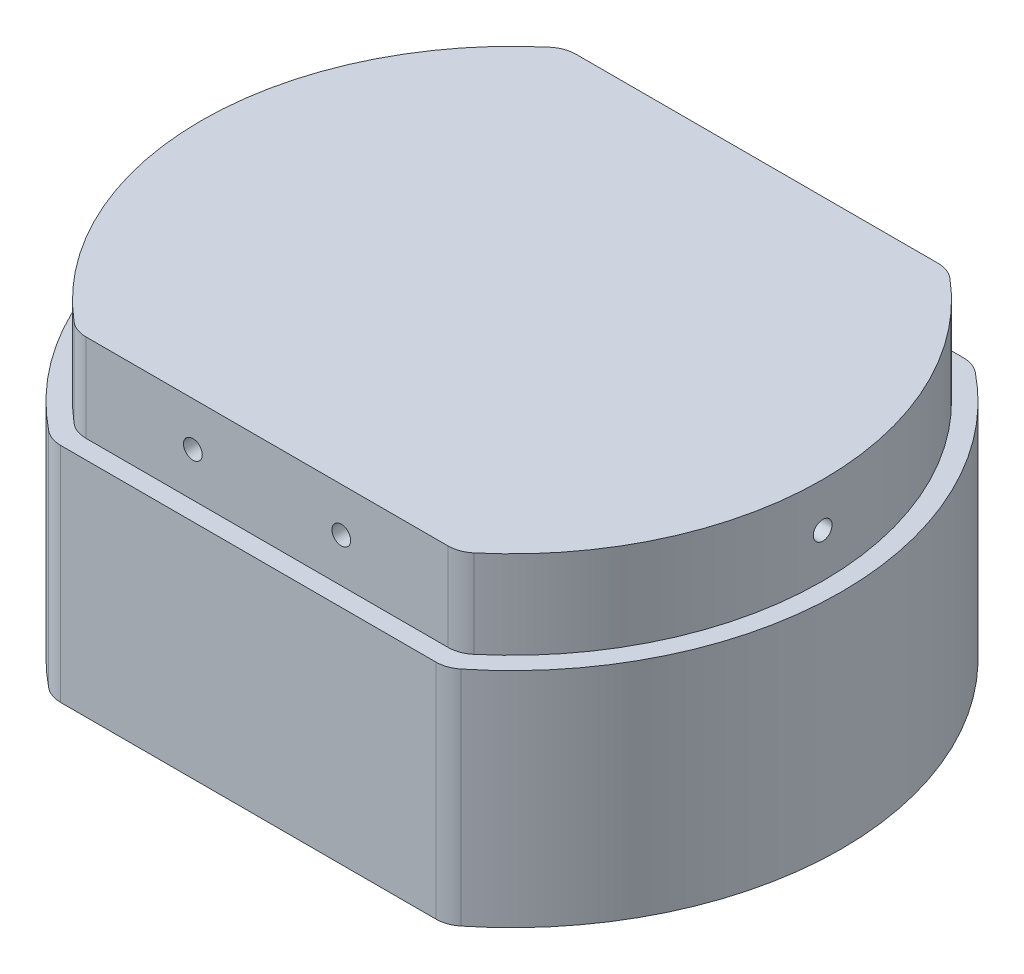
from build123d import *

# Parameters (mm, degrees)
Y_KSEKLIK_EKSTR_ZYON1_DEPTH = 53
KES_EKSTR_ZYON1_START       = -15
KES_EKSTR_ZYON1_DEPTH       = 15
M3_BO_LUKLU_DELIK2_D        = 3.2
M3_BO_LUKLU_DELIK2_DEPTH    = 6.9
M3_BO_LUKLU_DELIK2_TIP      = 0.96137699
M3_BO_LUKLU_DELIK1_D        = 3.2
M3_BO_LUKLU_DELIK1_DEPTH    = 6.9
M3_BO_LUKLU_DELIK1_TIP      = 0.96137699
RADYUS1_R                   = 5
DAIRESEL_KAPLAMA1_COUNT     = 2
DAIRESEL_KAPLAMA1_ANGLE     = 180


with BuildPart() as part:
    # Çizim1 → Yükseklik-Ekstrüzyon1 (new body)
    with BuildSketch(Plane(origin=(0, 0, 0), x_dir=(1, 0, 0), z_dir=(0, 1, 0))):
        with BuildLine():
            Line((-32.040014045, 45), (32.040014045, 45))
            ThreePointArc((32.040014045, 45), (33.696486936, 44.717636862), (35.165869074, 43.902439024))
            ThreePointArc((35.165869074, 43.902439024), (56.25, 0), (35.165869074, -43.902439024))
            ThreePointArc((35.165869074, -43.902439024), (33.696486936, -44.717636862), (32.040014045, -45))
            Line((32.040014045, -45), (-32.040014045, -45))
            ThreePointArc((-32.040014045, -45), (-33.696486936, -44.717636862), (-35.165869074, -43.902439024))
            ThreePointArc((-35.165869074, -43.902439024), (-56.25, 0), (-35.165869074, 43.902439024))
            ThreePointArc((-35.165869074, 43.902439024), (-33.696486936, 44.717636862), (-32.040014045, 45))
        make_face()
    extrude(amount=Y_KSEKLIK_EKSTR_ZYON1_DEPTH)

    # Çizim2 → Kes-Ekstrüzyon1 (cut)
    with BuildSketch(Plane(origin=(0, 53, 0), x_dir=(1, 0, 0), z_dir=(0, 1, 0)).offset(KES_EKSTR_ZYON1_START)):
        with BuildLine():
            Line((33.75, 45), (-33.75, 45))
            ThreePointArc((-33.75, 45), (-56.25, 0), (-33.75, -45))
            Line((-33.75, -45), (33.75, -45))
            ThreePointArc((33.75, -45), (56.25, 0), (33.75, 45))
        make_face()
        with BuildLine():
            Line((32.665922611, -41.8), (-32.665922611, -41.8))
            ThreePointArc((-32.665922611, -41.8), (-53.05, 0), (-32.665922611, 41.8))
            Line((-32.665922611, 41.8), (32.665922611, 41.8))
            ThreePointArc((32.665922611, 41.8), (53.05, 0), (32.665922611, -41.8))
        make_face(mode=Mode.SUBTRACT)
    extrude(amount=KES_EKSTR_ZYON1_DEPTH, mode=Mode.SUBTRACT)

    # M3 Boşluklu Delik2
    with Locations(Plane(origin=(0, 0, -41.8), x_dir=(-1, 0, 0), z_dir=(0, 0, -1))):
        with Locations((12.665922611, 45.5), (-12.665922611, 45.5)):
            Hole(M3_BO_LUKLU_DELIK2_D / 2, depth=M3_BO_LUKLU_DELIK2_DEPTH)
            with Locations((0, 0, -(M3_BO_LUKLU_DELIK2_DEPTH + M3_BO_LUKLU_DELIK2_TIP / 2))):  # 118° drill point
                Cone(0, M3_BO_LUKLU_DELIK2_D / 2, M3_BO_LUKLU_DELIK2_TIP, mode=Mode.SUBTRACT)

    # M3 Boşluklu Delik1
    with Locations(Plane.XY.offset(41.8)):
        with Locations((12.665922611, 45.5), (-12.665922611, 45.5)):
            Hole(M3_BO_LUKLU_DELIK1_D / 2, depth=M3_BO_LUKLU_DELIK1_DEPTH)
            with Locations((0, 0, -(M3_BO_LUKLU_DELIK1_DEPTH + M3_BO_LUKLU_DELIK1_TIP / 2))):  # 118° drill point
                Cone(0, M3_BO_LUKLU_DELIK1_D / 2, M3_BO_LUKLU_DELIK1_TIP, mode=Mode.SUBTRACT)

    # Radyus1
    radyus1_edges = [part.edges().sort_by_distance(p)[0] for p in [
        (-32.665922611, 45.5, -41.8),
        (32.665922611, 45.5, -41.8),
        (32.665922611, 45.5, 41.8),
        (-32.665922611, 45.5, 41.8),
    ]]
    fillet(radyus1_edges, radius=RADYUS1_R)

    # Çizim19 → M3 Boşluklu Delik3 (revolve, cut)
    with BuildSketch(Plane(origin=(53.05, 45.5, 0), x_dir=(0, 0, -1), z_dir=(0, 1, 0))):
        Polygon((0, 0), (0, 12.76137699), (1.6, 11.8), (1.6, 0), align=None)
    m3_bo_luklu_delik3 = revolve(axis=Axis((59.4, 45.5, 0), (-1, 0, 0)), mode=Mode.SUBTRACT)

    # Dairesel Kaplama1: M3 Boşluklu Delik3 ×2 about axis
    dairesel_kaplama1_axis = Axis((0, 53, 0), (0, 1, 0))
    for i in range(1, DAIRESEL_KAPLAMA1_COUNT):
        add(m3_bo_luklu_delik3.rotate(dairesel_kaplama1_axis, i * DAIRESEL_KAPLAMA1_ANGLE / (DAIRESEL_KAPLAMA1_COUNT - 1)), mode=Mode.SUBTRACT)


solid = part.part
